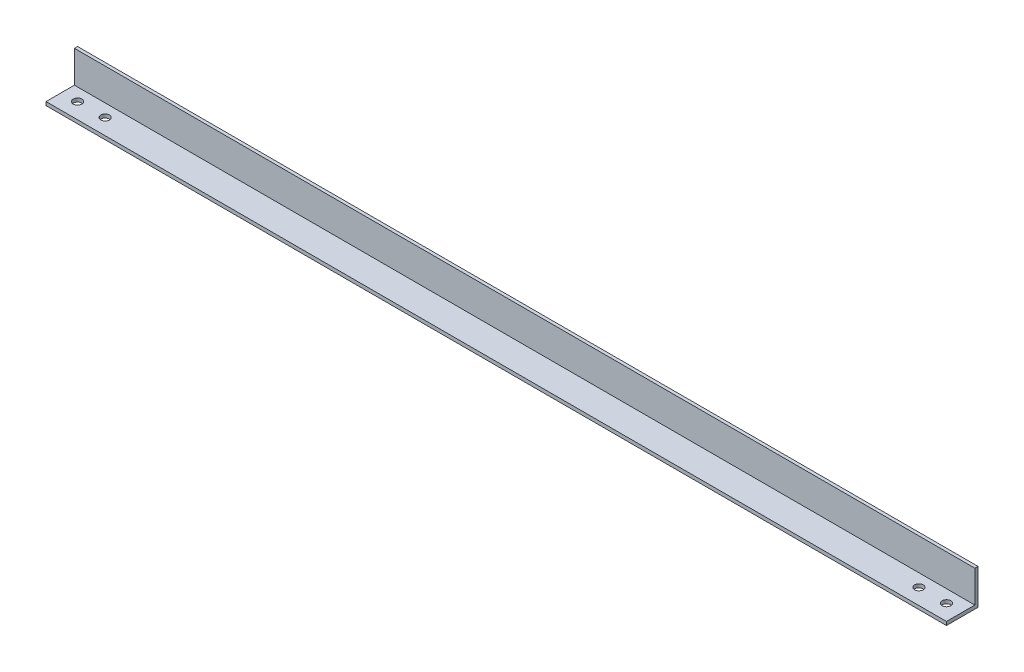
from build123d import *

# Parameters (mm, degrees)
SKETCH_198_W        = 2284
SKETCH_198_H        = 90
EXTRUDE_4_DEPTH     = 8
SKETCH_3_W          = 2284
SKETCH_3_H          = 9
EXTRUDE_5_DEPTH     = 72
SKETCH_4_R          = 11
CUT_EXTRUDE_2_DEPTH = 2287.835586569


with BuildPart() as part:
    # Sketch 198 → 拉伸4 (new body)
    with BuildSketch(Plane.XY):
        with Locations((1142, 45)):
            Rectangle(SKETCH_198_W, SKETCH_198_H)
    extrude(amount=EXTRUDE_4_DEPTH)

    # 草图3 → 拉伸5 (add)
    with BuildSketch(Plane.XY.offset(8)):
        with Locations((1142, 4.5)):
            Rectangle(SKETCH_3_W, SKETCH_3_H)
    extrude(amount=EXTRUDE_5_DEPTH)

    # 草图4 → 切除-拉伸2 (cut, through all)
    with BuildSketch(Plane(origin=(0, 9, 0), x_dir=(1, 0, 0), z_dir=(0, 1, 0))):
        with Locations(Location((39.95, -40, 0), (0, 0, 270))):
            Circle(SKETCH_4_R)
        with Locations(Location((109.95, -40, 0), (0, 0, 270))):
            Circle(SKETCH_4_R)
        with Locations(Location((2174.05, -40, 0), (0, 0, 270))):
            Circle(SKETCH_4_R)
        with Locations(Location((2244.05, -40, 0), (0, 0, 270))):
            Circle(SKETCH_4_R)
    extrude(amount=-CUT_EXTRUDE_2_DEPTH, mode=Mode.SUBTRACT)


solid = part.part
